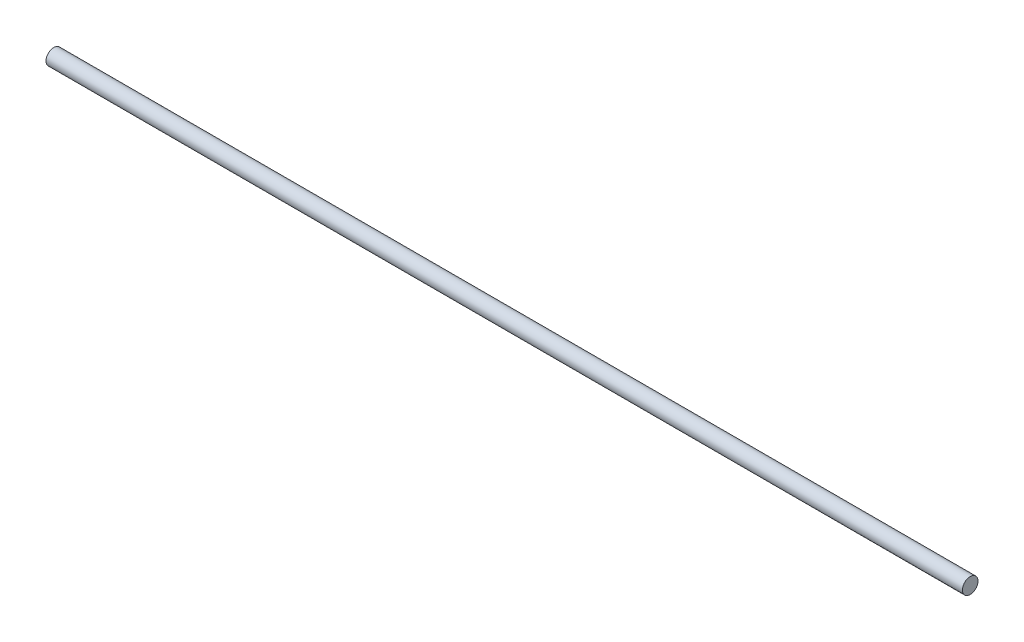
from build123d import *

# Parameters (mm, degrees)
SKETCH3_R           = 4
BOSS_EXTRUDE1_DEPTH = 470


with BuildPart() as part:
    # Sketch3 → Boss-Extrude1 (new body)
    with BuildSketch(Plane(origin=(0, 0, 0), x_dir=(0, 0, -1), z_dir=(1, 0, 0))):
        with Locations(Location((0, 0, 0), (0, 0, 180))):
            Circle(SKETCH3_R)
    extrude(amount=BOSS_EXTRUDE1_DEPTH)


solid = part.part
